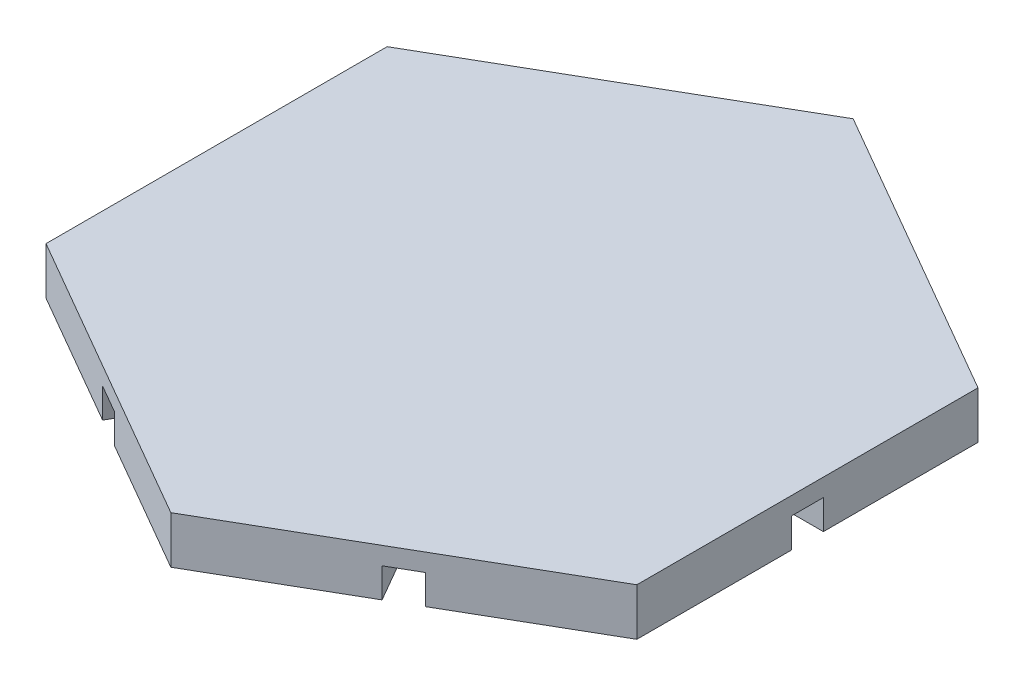
from build123d import *

# Parameters (mm, degrees)
BOSS_EXTRUDE1_DEPTH     = 8
SKETCH2_W               = 100
SKETCH2_H               = 5.4
CUT_EXTRUDE_THIN1_DEPTH = 5


with BuildPart() as part:
    # Sketch1 → Boss-Extrude1 (new body)
    with BuildSketch(Plane(origin=(0, 0, 0), x_dir=(1, 0, 0), z_dir=(0, 1, 0))):
        Polygon((0, 57.735026919), (-50, 28.867513459), (-50, -28.867513459), (0, -57.735026919), (50, -28.867513459), (50, 28.867513459), align=None)
    extrude(amount=BOSS_EXTRUDE1_DEPTH)

    # Sketch2 → Cut-Extrude-Thin1 (cut)
    with BuildSketch(Plane.XZ):
        Polygon((-27.33826859, 41.951270189), (22.66173141, -44.651270189), (27.33826859, -41.951270189), (-22.66173141, 44.651270189), align=None)
        Polygon((22.66173141, 44.651270189), (-27.33826859, -41.951270189), (-22.66173141, -44.651270189), (27.33826859, 41.951270189), align=None)
        Rectangle(SKETCH2_W, SKETCH2_H)
    extrude(amount=-CUT_EXTRUDE_THIN1_DEPTH, mode=Mode.SUBTRACT)


solid = part.part
